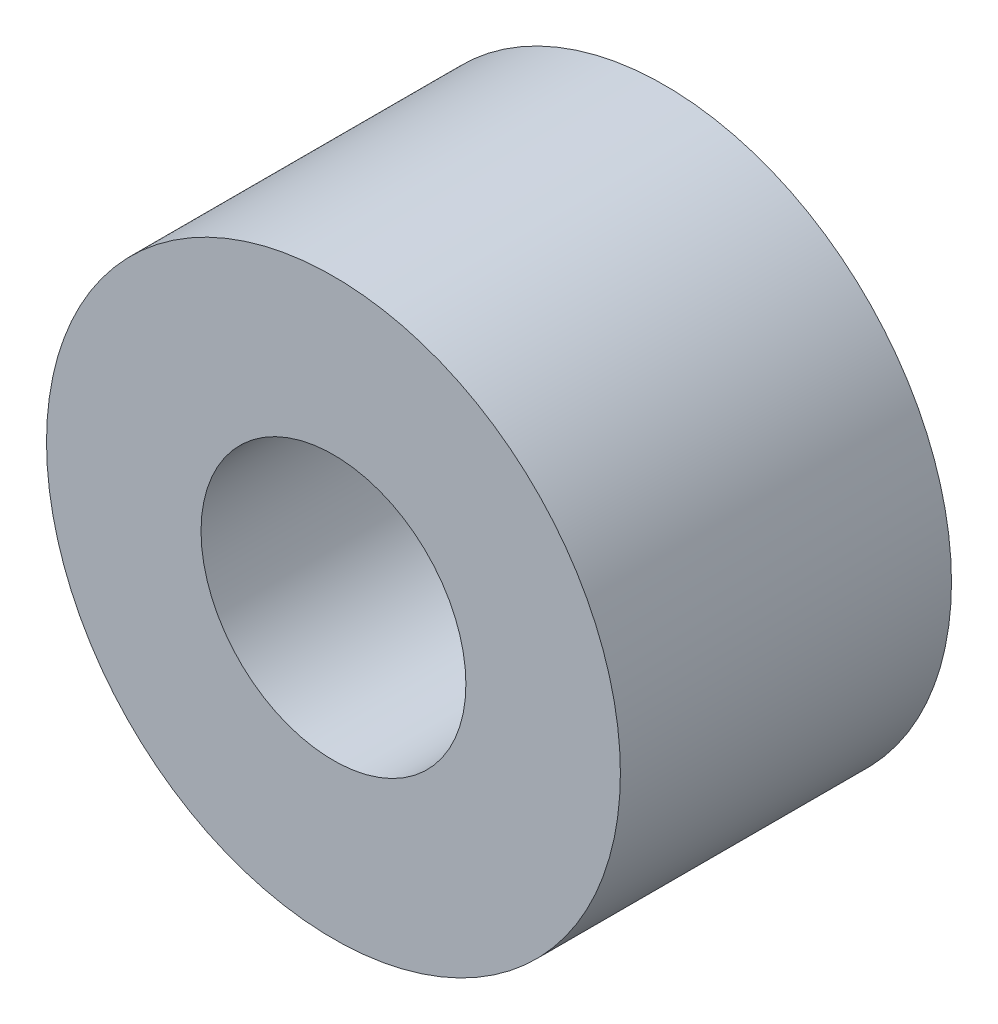
from build123d import *

# Parameters (mm, degrees)
SKETCH1_R           = 6.5
SKETCH1_R_2         = 3
BOSS_EXTRUDE1_DEPTH = 7.5


with BuildPart() as part:
    # Sketch1 → Boss-Extrude1 (new body)
    with BuildSketch(Plane.XY):
        Circle(SKETCH1_R)
        Circle(SKETCH1_R_2, mode=Mode.SUBTRACT)
    extrude(amount=BOSS_EXTRUDE1_DEPTH)


solid = part.part
